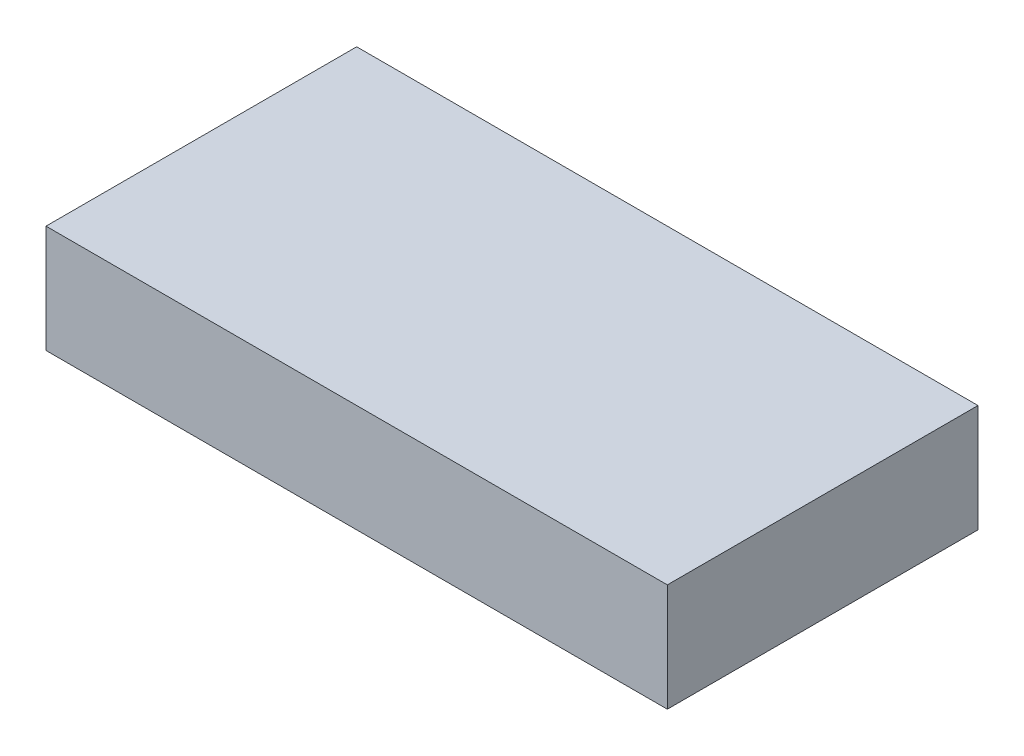
from build123d import *

# Parameters (mm, degrees)
SKETCH_1_W                   = 150
SKETCH_1_H                   = 26
SOLID_OBS_04_LEFT_WALL_DEPTH = 75


with BuildPart() as part:
    # 草图1 → solid_obs_04_left_wall (new body)
    with BuildSketch(Plane.XY):
        Rectangle(SKETCH_1_W, SKETCH_1_H)
    extrude(amount=SOLID_OBS_04_LEFT_WALL_DEPTH)


solid = part.part
